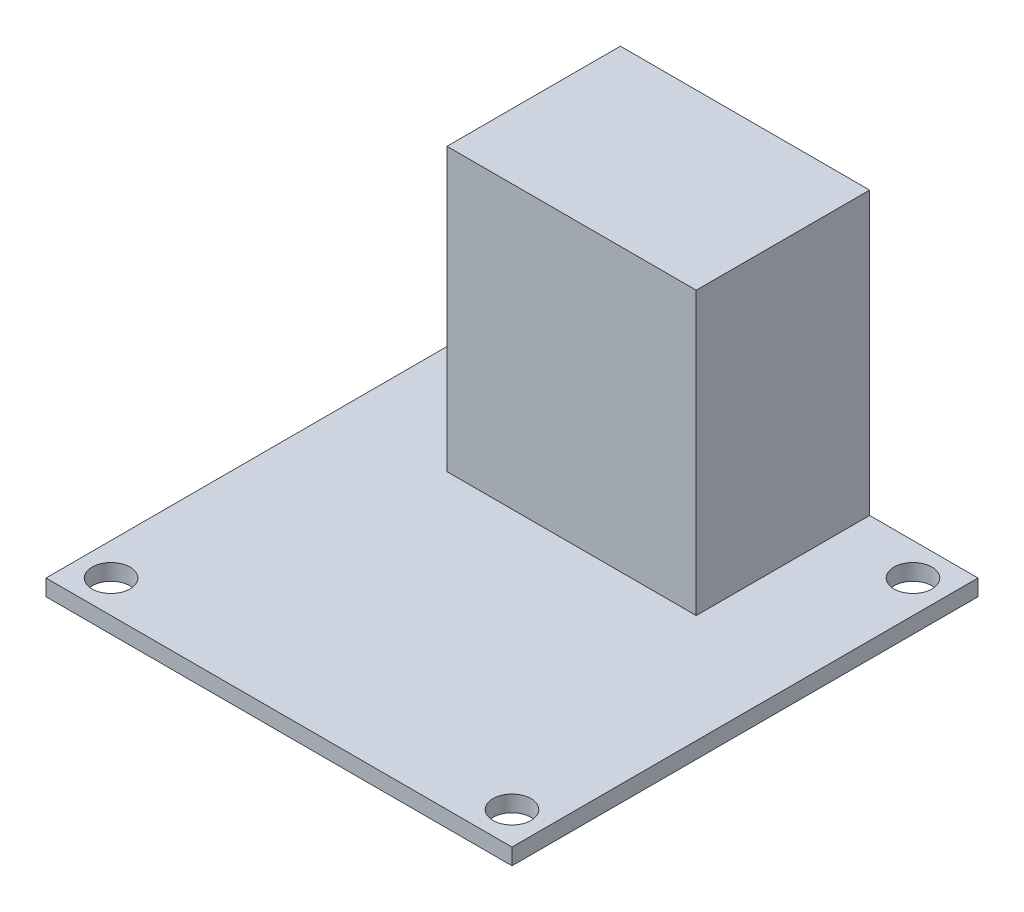
from build123d import *

# Parameters (mm, degrees)
SKETCH_1_W          = 43
SKETCH_1_H          = 43
EXTRUDE_1_DEPTH     = 1.5
SKETCH_2_R          = 1.75
CUT_EXTRUDE_1_DEPTH = 1.5
SKETCH_3_W          = 23
SKETCH_3_H          = 16
EXTRUDE_2_DEPTH     = 26


with BuildPart() as part:
    # 草图1 → 凸台-拉伸1 (new body)
    with BuildSketch(Plane(origin=(0, 0, 0), x_dir=(1, 0, 0), z_dir=(0, 1, 0))):
        Rectangle(SKETCH_1_W, SKETCH_1_H)
    extrude(amount=EXTRUDE_1_DEPTH)

    # 草图2 → 切除-拉伸1 (cut)
    with BuildSketch(Plane(origin=(0, 1.5, 0), x_dir=(1, 0, 0), z_dir=(0, 1, 0))):
        with Locations(Location((-18.5, 18.5, 0), (0, 0, 270))):
            Circle(SKETCH_2_R)
        with Locations(Location((18.5, 18.5, 0), (0, 0, 90))):
            Circle(SKETCH_2_R)
        with Locations(Location((-18.5, -18.5, 0), (0, 0, 90))):
            Circle(SKETCH_2_R)
        with Locations(Location((18.5, -18.5, 0), (0, 0, 270))):
            Circle(SKETCH_2_R)
    extrude(amount=-CUT_EXTRUDE_1_DEPTH, mode=Mode.SUBTRACT)

    # 草图3 → 凸台-拉伸2 (add)
    with BuildSketch(Plane(origin=(0, 1.5, 0), x_dir=(1, 0, 0), z_dir=(0, 1, 0))):
        with Locations((0, 13.5)):
            Rectangle(SKETCH_3_W, SKETCH_3_H)
    extrude(amount=EXTRUDE_2_DEPTH)


solid = part.part
